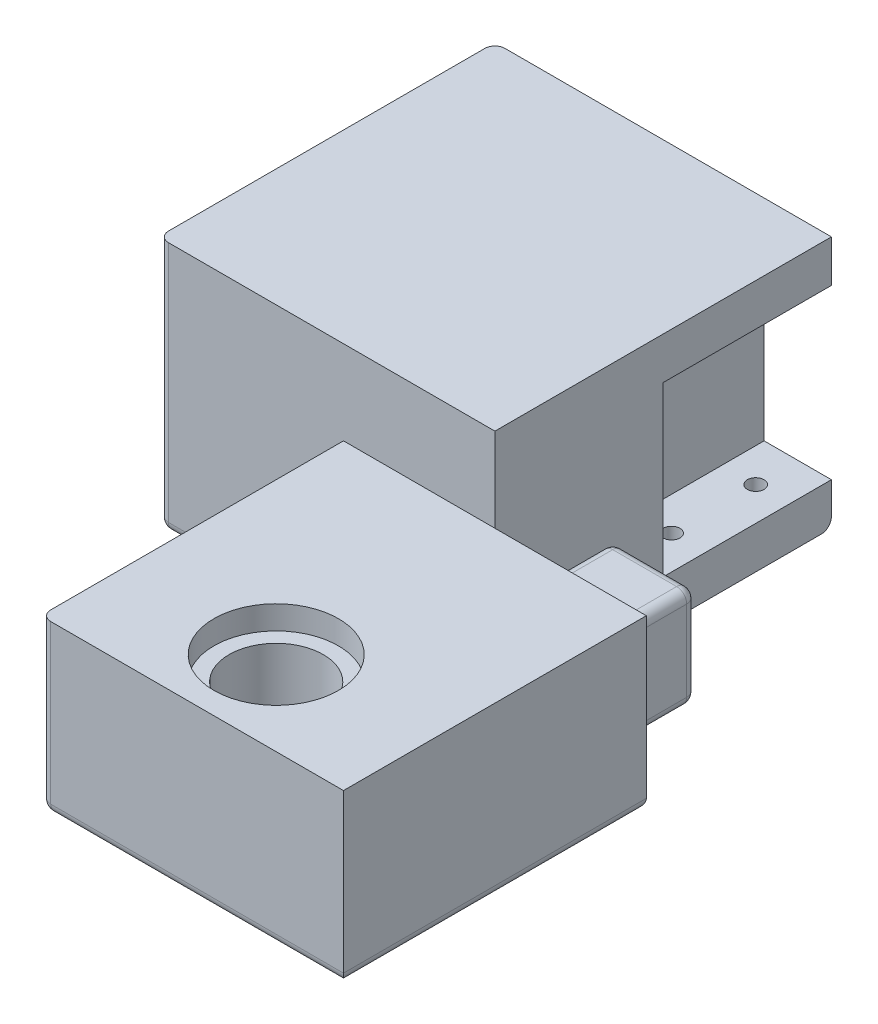
from build123d import *

# Parameters (mm, degrees)
SKETCH1_W           = 100
SKETCH1_H           = 100
BOSS_EXTRUDE1_DEPTH = 50
SKETCH8_W           = 90
SKETCH8_H           = 90
BOSS_EXTRUDE4_DEPTH = 50
SKETCH9_R           = 18.5
CUT_EXTRUDE1_DEPTH  = 7
SKETCH10_R          = 14
CUT_EXTRUDE2_DEPTH  = 25
SKETCH11_W          = 25
SKETCH11_H          = 30
BOSS_EXTRUDE5_DEPTH = 25
SKETCH12_W          = 100
SKETCH12_H          = 100
BOSS_EXTRUDE6_DEPTH = 25
SKETCH13_W          = 20
SKETCH13_H          = 50
CUT_EXTRUDE3_DEPTH  = 50
SKETCH14_R          = 2
CUT_EXTRUDE4_DEPTH  = 15
SKETCH15_R          = 2.5
CUT_EXTRUDE5_DEPTH  = 15
SKETCH16_R          = 3.75
CUT_EXTRUDE6_DEPTH  = 4
FILLET1_R           = 3


with BuildPart() as part:
    # Sketch1 → Boss-Extrude1 (new body)
    with BuildSketch(Plane(origin=(0, 0, 0), x_dir=(1, 0, 0), z_dir=(0, 1, 0))):
        Rectangle(SKETCH1_W, SKETCH1_H)
    extrude(amount=BOSS_EXTRUDE1_DEPTH)

    # Sketch8 → Boss-Extrude4 (add)
    with BuildSketch(Plane(origin=(0, 50, 0), x_dir=(1, 0, 0), z_dir=(0, 1, 0))):
        with Locations((50, -95)):
            Rectangle(SKETCH8_W, SKETCH8_H)
    extrude(amount=-BOSS_EXTRUDE4_DEPTH)

    # Sketch9 → Cut-Extrude1 (cut)
    with BuildSketch(Plane(origin=(0, 50, 0), x_dir=(1, 0, 0), z_dir=(0, 1, 0))):
        with Locations(Location((50, -115, 0), (0, 0, 270))):
            Circle(SKETCH9_R)
    extrude(amount=-CUT_EXTRUDE1_DEPTH, mode=Mode.SUBTRACT)

    # Sketch10 → Cut-Extrude2 (cut)
    with BuildSketch(Plane(origin=(0, 50, 0), x_dir=(1, 0, 0), z_dir=(0, 1, 0))):
        with Locations(Location((50, -115, 0), (0, 0, 270))):
            Circle(SKETCH10_R)
    extrude(amount=-CUT_EXTRUDE2_DEPTH, mode=Mode.SUBTRACT)

    # Sketch11 → Boss-Extrude5 (add)
    with BuildSketch(Plane(origin=(0, 0, 50), x_dir=(-1, 0, 0), z_dir=(0, 0, -1))):
        with Locations((-72.5, 25)):
            Rectangle(SKETCH11_W, SKETCH11_H)
    extrude(amount=BOSS_EXTRUDE5_DEPTH)

    # Sketch12 → Boss-Extrude6 (add)
    with BuildSketch(Plane(origin=(0, 50, 0), x_dir=(1, 0, 0), z_dir=(0, 1, 0))):
        Rectangle(SKETCH12_W, SKETCH12_H)
    extrude(amount=BOSS_EXTRUDE6_DEPTH)

    # Sketch13 → Cut-Extrude3 (cut)
    with BuildSketch(Plane(origin=(0, 0, -50), x_dir=(-1, 0, 0), z_dir=(0, 0, -1))):
        with Locations((-40, 37.5)):
            Rectangle(SKETCH13_W, SKETCH13_H)
    extrude(amount=-CUT_EXTRUDE3_DEPTH, mode=Mode.SUBTRACT)

    # Sketch14 → Cut-Extrude4 (cut)
    with BuildSketch(Plane.XZ.offset(-10)):
        with Locations(Location((72.5, 37.5, 0), (0, 0, 270))):
            Circle(SKETCH14_R)
    extrude(amount=-CUT_EXTRUDE4_DEPTH, mode=Mode.SUBTRACT)

    # Sketch15 → Cut-Extrude5 (cut)
    with BuildSketch(Plane.XZ):
        with Locations(Location((40, -37.5, 0), (0, 0, 270))):
            Circle(SKETCH15_R)
        with Locations((40, -12.5)):
            Circle(SKETCH15_R)
    extrude(amount=-CUT_EXTRUDE5_DEPTH, mode=Mode.SUBTRACT)

    # Sketch16 → Cut-Extrude6 (cut)
    with BuildSketch(Plane.XZ):
        with Locations(Location((40, -12.5, 0), (0, 0, 270))):
            Circle(SKETCH16_R)
        with Locations(Location((40, -37.5, 0), (0, 0, 90))):
            Circle(SKETCH16_R)
    extrude(amount=-CUT_EXTRUDE6_DEPTH, mode=Mode.SUBTRACT)

    # Fillet1
    fillet1_edges = [part.edges().sort_by_distance(p)[0] for p in [
        (5, 25, 140),
        (95, 0, 95),
        (50, 0, 140),
        (5, 0, 95),
        (72.5, 0, 50),
        (60, 10, 37.5),
        (60, 40, 37.5),
        (85, 40, 37.5),
        (85, 10, 37.5),
        (60, 25, 25),
        (72.5, 40, 25),
        (85, 25, 25),
        (72.5, 10, 25),
        (-22.5, 0, 50),
        (-50, 0, 0),
        (0, 0, -50),
        (-50, 37.5, 50),
        (-50, 37.5, -50),
    ]]
    fillet(fillet1_edges, radius=FILLET1_R)


solid = part.part
